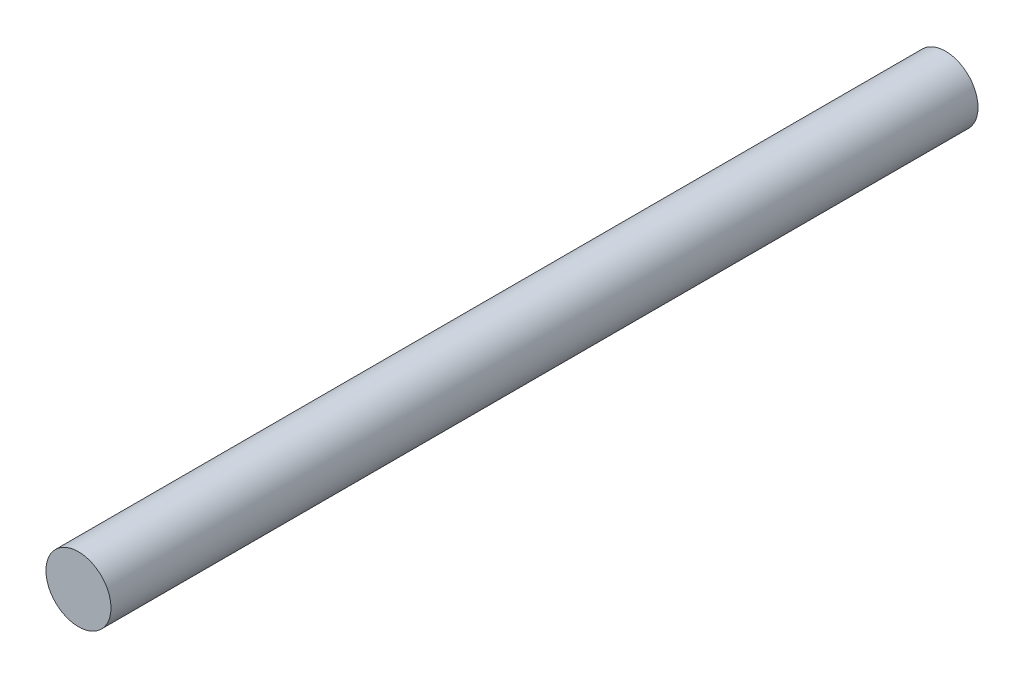
from build123d import *

# Parameters (mm, degrees)
SKETCH1_R           = 37.5
BOSS_EXTRUDE1_DEPTH = 1000


with BuildPart() as part:
    # Sketch1 → Boss-Extrude1 (new body)
    with BuildSketch(Plane.XY):
        Circle(SKETCH1_R)
    extrude(amount=BOSS_EXTRUDE1_DEPTH)


solid = part.part
